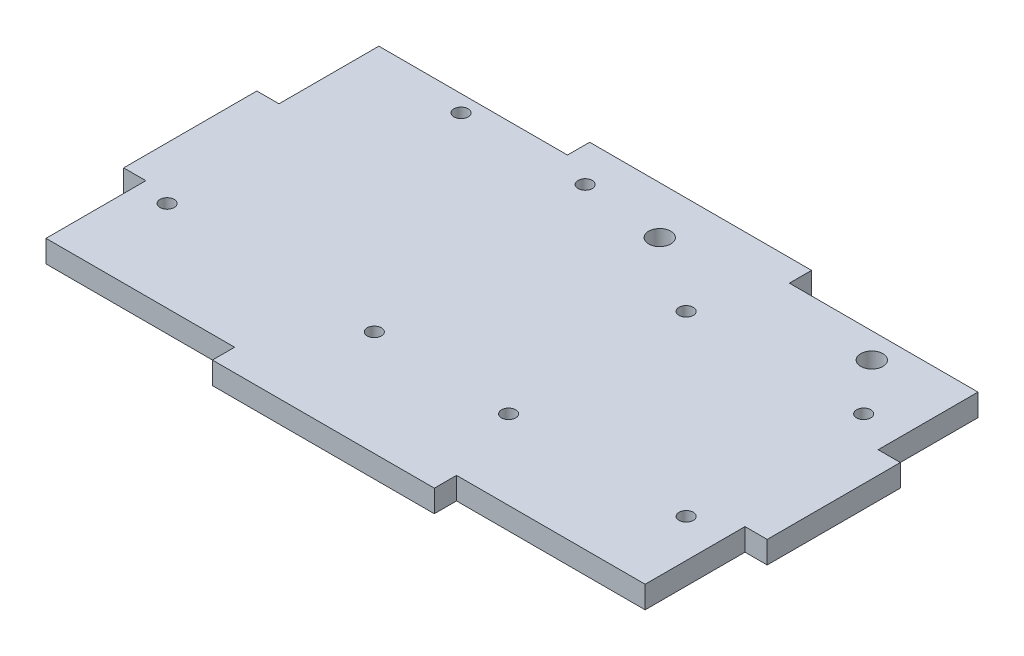
from build123d import *

# Parameters (mm, degrees)
SKETCH1_W           = 145
SKETCH1_H           = 85
BOSS_EXTRUDE1_DEPTH = 5
SKETCH2_W           = 47.5
SKETCH2_H           = 5
CUT_EXTRUDE1_DEPTH  = 5
SKETCH3_W           = 5
SKETCH3_H           = 22.5
CUT_EXTRUDE2_DEPTH  = 5
SKETCH4_R           = 1.6
CUT_EXTRUDE3_DEPTH  = 5
SKETCH5_R           = 1.6
CUT_EXTRUDE4_DEPTH  = 5
SKETCH6_R           = 2.5
CUT_EXTRUDE5_DEPTH  = 10


with BuildPart() as part:
    # Sketch1 → Boss-Extrude1 (new body)
    with BuildSketch(Plane(origin=(0, 0, 0), x_dir=(1, 0, 0), z_dir=(0, 1, 0))):
        Rectangle(SKETCH1_W, SKETCH1_H)
    extrude(amount=BOSS_EXTRUDE1_DEPTH)

    # Sketch2 → Cut-Extrude1 (cut)
    with BuildSketch(Plane(origin=(0, 5, 0), x_dir=(1, 0, 0), z_dir=(0, 1, 0))):
        with Locations((-48.75, 40)):
            Rectangle(SKETCH2_W, SKETCH2_H)
        with Locations((48.75, 40)):
            Rectangle(SKETCH2_W, SKETCH2_H)
        with Locations((48.75, -40)):
            Rectangle(SKETCH2_W, SKETCH2_H)
        with Locations((-48.75, -40)):
            Rectangle(SKETCH2_W, SKETCH2_H)
    extrude(amount=-CUT_EXTRUDE1_DEPTH, mode=Mode.SUBTRACT)

    # Sketch3 → Cut-Extrude2 (cut)
    with BuildSketch(Plane(origin=(0, 5, 0), x_dir=(1, 0, 0), z_dir=(0, 1, 0))):
        with Locations((-70, 26.25)):
            Rectangle(SKETCH3_W, SKETCH3_H)
        with Locations((-70, -26.25)):
            Rectangle(SKETCH3_W, SKETCH3_H)
        with Locations((70, -26.25)):
            Rectangle(SKETCH3_W, SKETCH3_H)
        with Locations((70, 26.25)):
            Rectangle(SKETCH3_W, SKETCH3_H)
    extrude(amount=-CUT_EXTRUDE2_DEPTH, mode=Mode.SUBTRACT)

    # Sketch4 → Cut-Extrude3 (cut)
    with BuildSketch(Plane(origin=(0, 5, 0), x_dir=(1, 0, 0), z_dir=(0, 1, 0))):
        with Locations(Location((-12.26, -18.77, 0), (0, 0, 270))):
            Circle(SKETCH4_R)
        with Locations(Location((-60.66, -17.06, 0), (0, 0, 270))):
            Circle(SKETCH4_R)
        with Locations(Location((-45.22, 33.75, 0), (0, 0, 270))):
            Circle(SKETCH4_R)
        with Locations(Location((-17.26, 33.75, 0), (0, 0, 270))):
            Circle(SKETCH4_R)
    extrude(amount=-CUT_EXTRUDE3_DEPTH, mode=Mode.SUBTRACT)

    # Sketch5 → Cut-Extrude4 (cut)
    with BuildSketch(Plane(origin=(0, 5, 0), x_dir=(1, 0, 0), z_dir=(0, 1, 0))):
        with Locations(Location((58.87, 20.37, 0), (0, 0, 270))):
            Circle(SKETCH5_R)
        with Locations(Location((18.87, 20.37, 0), (0, 0, 270))):
            Circle(SKETCH5_R)
        with Locations(Location((18.87, -19.63, 0), (0, 0, 270))):
            Circle(SKETCH5_R)
        with Locations(Location((58.87, -19.63, 0), (0, 0, 270))):
            Circle(SKETCH5_R)
    extrude(amount=-CUT_EXTRUDE4_DEPTH, mode=Mode.SUBTRACT)

    # Sketch6 → Cut-Extrude5 (cut)
    with BuildSketch(Plane(origin=(0, 5, 0), x_dir=(1, 0, 0), z_dir=(0, 1, 0))):
        with Locations(Location((49.29, 31.79, 0), (0, 0, 270))):
            Circle(SKETCH6_R)
        with Locations(Location((1.5, 31.79, 0), (0, 0, 270))):
            Circle(SKETCH6_R)
    extrude(amount=-CUT_EXTRUDE5_DEPTH, mode=Mode.SUBTRACT)


solid = part.part
